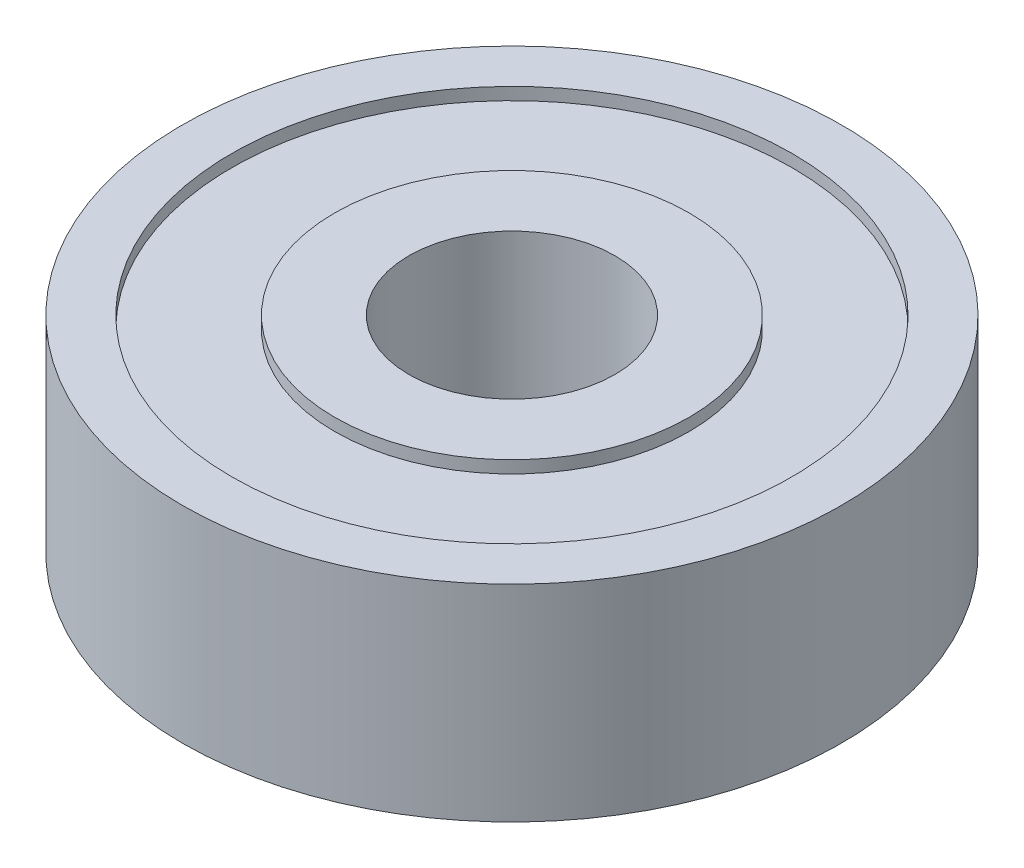
from build123d import *


with BuildPart() as part:
    # Sketch1 → Revolve1 (revolve)
    with BuildSketch(Plane(origin=(0, 0, 0), x_dir=(0, 0, -1), z_dir=(1, 0, 0)), mode=Mode.PRIVATE) as revolve1_sk:
        Polygon((6.8, 2.5), (8, 2.5), (8, -2.5), (6.8, -2.5), (6.8, -2.2), (4.3, -2.2), (4.3, -2.5), (2.5, -2.5), (2.5, 2.5), (4.3, 2.5), (4.3, 2.2), (6.8, 2.2), align=None)
    revolve(revolve1_sk.sketch.rotate(Axis((0, 4.825, 0), (0, -1, 0)), 180), axis=Axis((0, 4.825, 0), (0, -1, 0)))


solid = part.part
